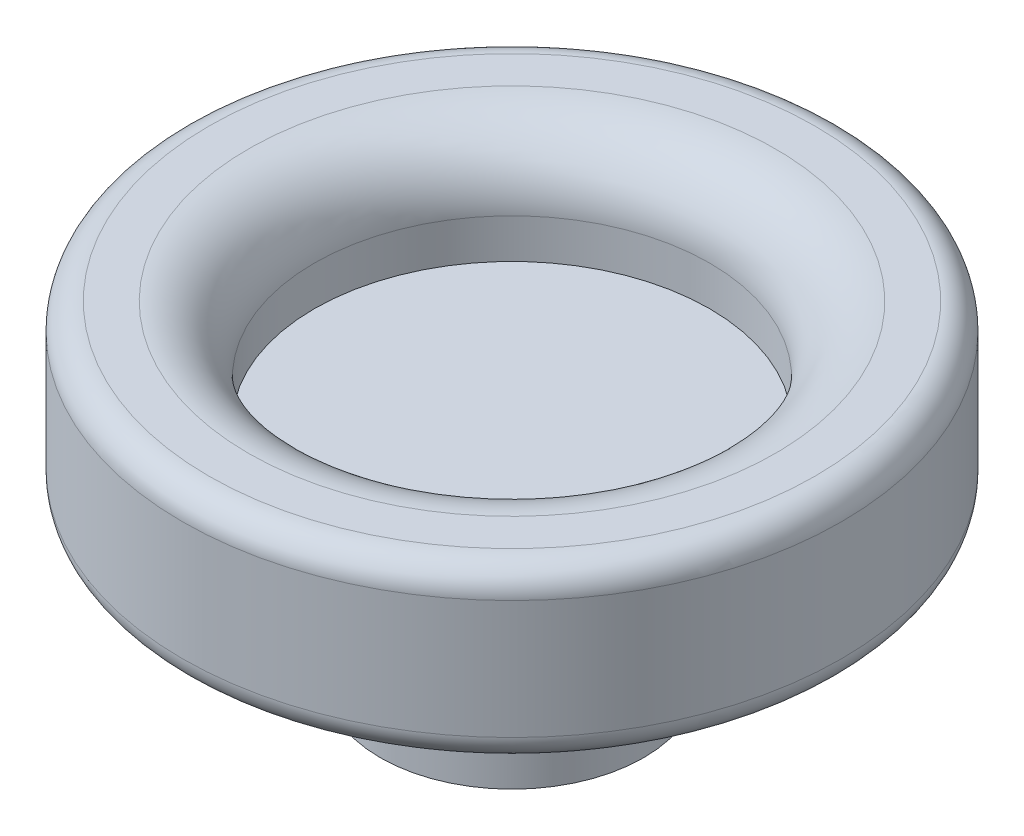
from build123d import *

# Parameters (mm, degrees)
SKETCH1_R                = 10
SKETCH1_R_2              = 7.5
BOSS_EXTRUDE1_DEPTH      = 15
BOSS_EXTRUDE2_DEPTH      = 10
BOSS_EXTRUDE2_DEPTH_BACK = 3
SKETCH3_R                = 25
FILLET1_R                = 2
SKETCH4_R                = 15
CUT_EXTRUDE1_DEPTH       = 8
FILLET2_R                = 5


with BuildPart() as part:
    # Sketch1 → Boss-Extrude1 (new body)
    with BuildSketch(Plane(origin=(0, 0, 0), x_dir=(1, 0, 0), z_dir=(0, 1, 0))):
        with Locations(Location((0, 0, 0), (0, 0, 270))):
            Circle(SKETCH1_R)
        with Locations(Location((0, 0, 0), (0, 0, 270))):
            Circle(SKETCH1_R_2, mode=Mode.SUBTRACT)
    extrude(amount=BOSS_EXTRUDE1_DEPTH)

    # Sketch3 → Boss-Extrude2 (add, two sides: drawn at the far end of the back side and taken through both)
    with BuildSketch(Plane(origin=(0, 15, 0), x_dir=(1, 0, 0), z_dir=(0, 1, 0)).offset(-BOSS_EXTRUDE2_DEPTH_BACK)):
        with Locations(Location((0, 0, 0), (0, 0, 270))):
            Circle(SKETCH3_R)
    extrude(amount=BOSS_EXTRUDE2_DEPTH + BOSS_EXTRUDE2_DEPTH_BACK)

    # Fillet1
    fillet1_edges = [part.edges().sort_by_distance(p)[0] for p in [
        (0, 12, -25),
        (0, 25, -25),
    ]]
    fillet(fillet1_edges, radius=FILLET1_R)

    # Sketch4 → Cut-Extrude1 (cut)
    with BuildSketch(Plane(origin=(0, 25, 0), x_dir=(1, 0, 0), z_dir=(0, 1, 0))):
        with Locations(Location((0, 0, 0), (0, 0, 270))):
            Circle(SKETCH4_R)
    extrude(amount=-CUT_EXTRUDE1_DEPTH, mode=Mode.SUBTRACT)

    # Fillet2
    fillet2_edges = [part.edges().sort_by_distance(p)[0] for p in [
        (0, 25, -15),
    ]]
    fillet(fillet2_edges, radius=FILLET2_R)


solid = part.part
